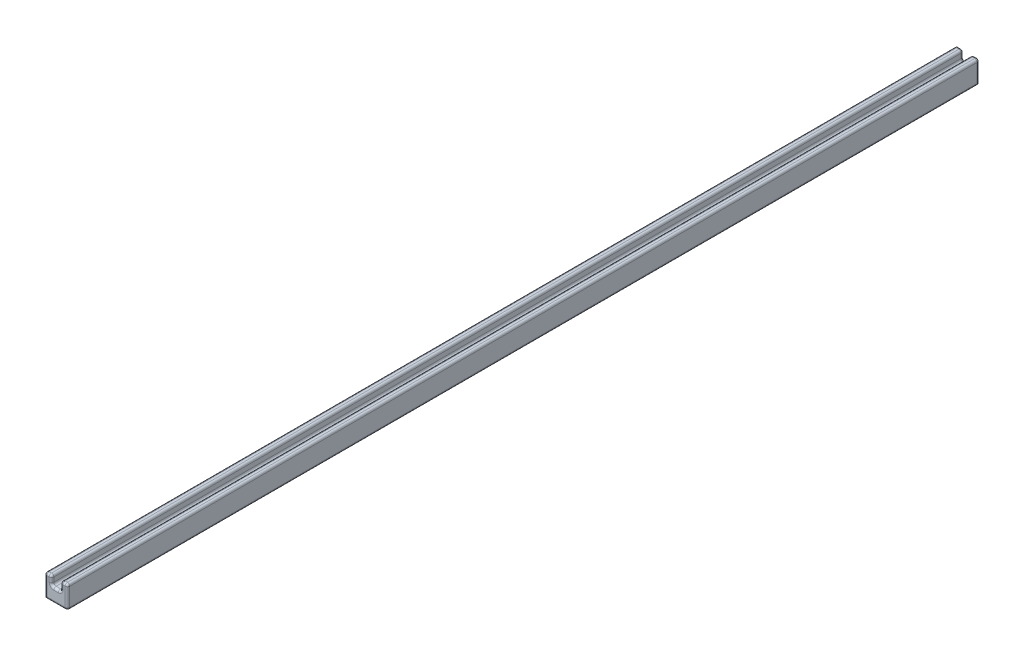
from build123d import *

# Parameters (mm, degrees)
BOSS_EXTRUDE1_DEPTH = 200
FILLET1_R           = 0.5


with BuildPart() as part:
    # Sketch1 → Boss-Extrude1 (new body)
    with BuildSketch(Plane.XY):
        Polygon((12.285714286, -3.026455026), (10.785714286, -3.026455026), (10.785714286, -8.026455026), (15.785714286, -8.026455026), (15.785714286, -3.026455026), (14.285714286, -3.026455026), (14.285714286, -5.026455026), (12.285714286, -5.026455026), align=None)
    extrude(amount=-BOSS_EXTRUDE1_DEPTH)

    # Fillet1
    fillet1_edges = [part.edges().sort_by_distance(p)[0] for p in [
        (11.535714286, -3.026455026, 0),
        (12.285714286, -4.026455026, 0),
        (13.285714286, -5.026455026, 0),
        (14.285714286, -4.026455026, 0),
        (15.035714286, -3.026455026, 0),
        (13.285714286, -5.026455026, -200),
        (15.785714286, -3.026455026, -100),
        (15.785714286, -8.026455026, -100),
        (10.785714286, -3.026455026, -100),
        (12.285714286, -3.026455026, -100),
        (12.285714286, -5.026455026, -100),
        (14.285714286, -5.026455026, -100),
        (14.285714286, -3.026455026, -100),
        (12.285714286, -4.026455026, -200),
        (11.535714286, -3.026455026, -200),
        (15.785714286, -5.526455026, -200),
        (15.035714286, -3.026455026, -200),
        (15.785714286, -5.526455026, 0),
        (14.285714286, -4.026455026, -200),
        (13.285714286, -8.026455026, 0),
        (10.785714286, -5.526455026, 0),
    ]]
    fillet(fillet1_edges, radius=FILLET1_R)


solid = part.part
